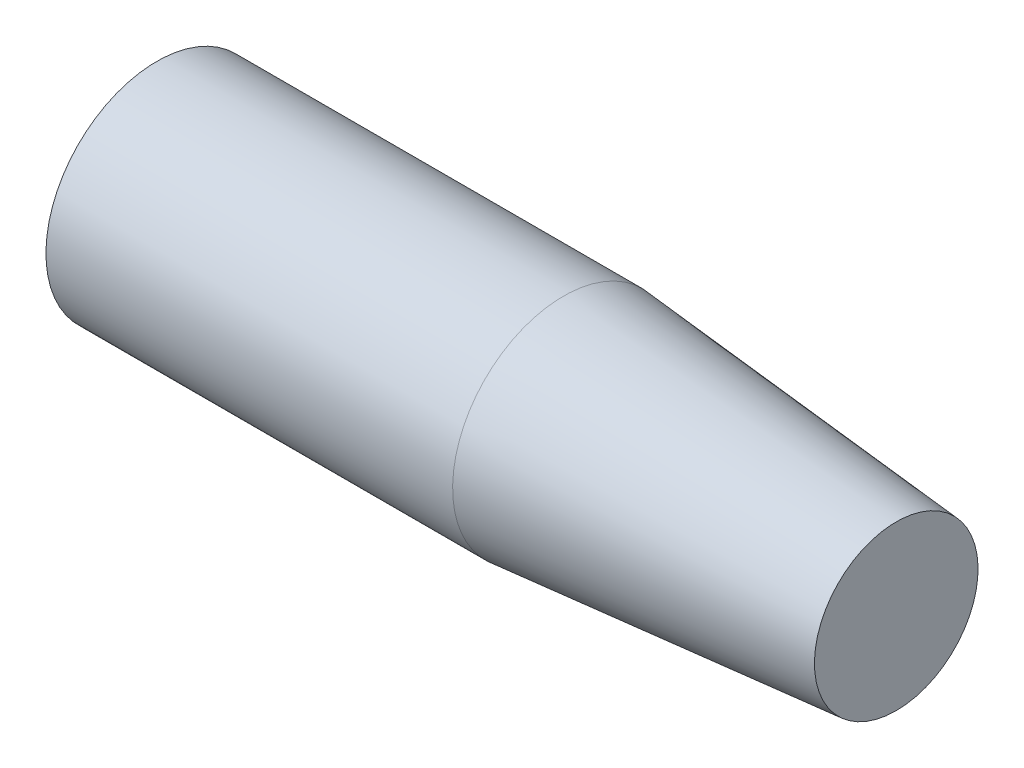
from build123d import *

# Parameters (mm, degrees)
WYTNIJ_WYCI_GNI_CIE1_DEPTH = 6


with BuildPart() as part:
    # Szkic1 → Obrót1 (revolve)
    with BuildSketch(Plane.XY, mode=Mode.PRIVATE) as obr_t1_sk:
        Polygon((0, 0), (0, 3), (11, 3), (20, 2.212602028), (20, 0), align=None)
    revolve(obr_t1_sk.sketch.rotate(Axis((0, 0, 0), (1, 0, 0)), 180), axis=Axis((0, 0, 0), (1, 0, 0)))

    # Szkic2 → Wytnij-wyciągnięcie1 (cut)
    with BuildSketch(Plane.ZY):
        Polygon((1.732050808, 0), (0.866025404, 1.5), (-0.866025404, 1.5), (-1.732050808, 0), (-0.866025404, -1.5), (0.866025404, -1.5), align=None)
    extrude(amount=-WYTNIJ_WYCI_GNI_CIE1_DEPTH, mode=Mode.SUBTRACT)


solid = part.part
